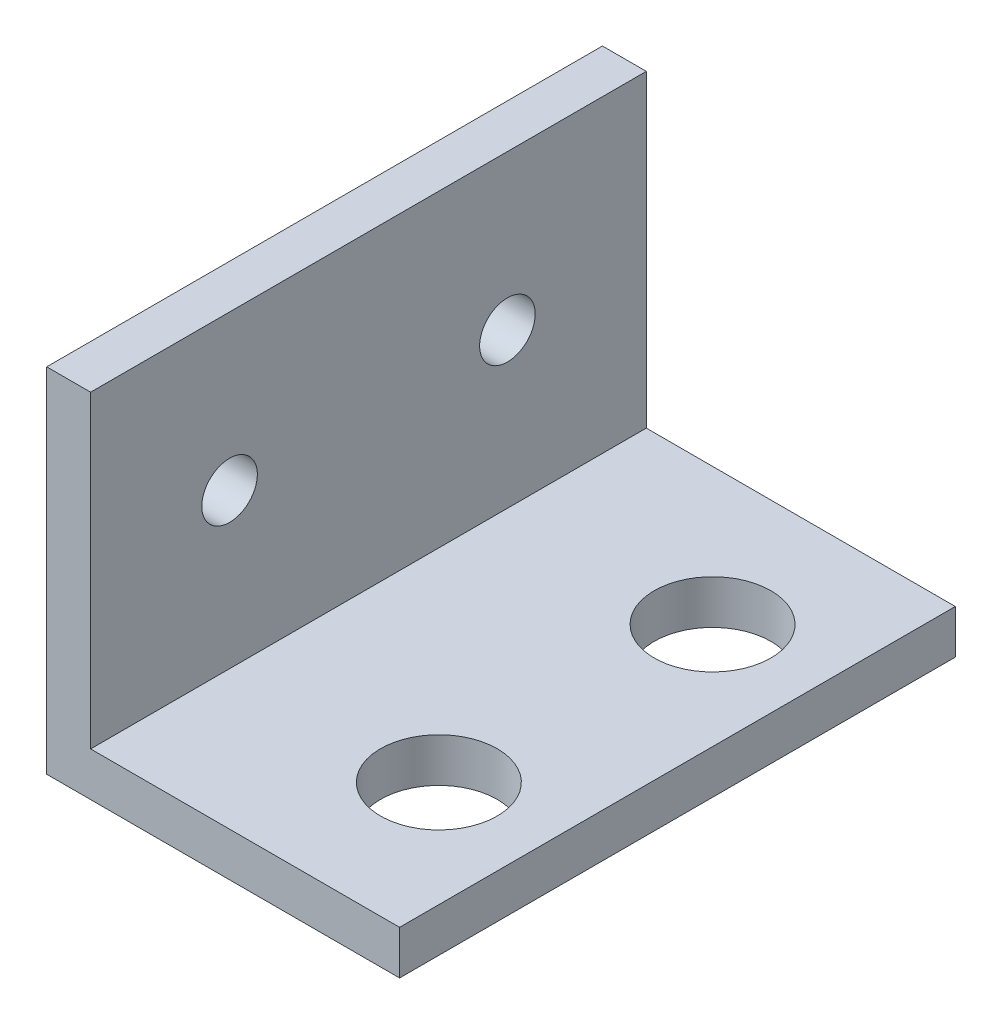
from build123d import *

# Parameters (mm, degrees)
BOSS_EXTRUDE1_DEPTH = 20
CUT_EXTRUDE1_REACH  = 28.881
CUT_EXTRUDE2_REACH  = 28.881


with BuildPart() as part:
    # Sketch1 → Boss-Extrude1 (new body)
    with BuildSketch(Plane.XY):
        Polygon((0, 0), (0, 12.7), (1.58, 12.7), (1.58, 1.58), (12.7, 1.58), (12.7, 0), align=None)
    extrude(amount=BOSS_EXTRUDE1_DEPTH)

    # Sketch2 → Cut-Extrude1 (cut, up to next)
    with BuildSketch(Plane.ZY, mode=Mode.PRIVATE) as cut_extrude1_sk1:
        with BuildLine():
            ThreePointArc((4, 7.14), (5, 6.14), (6, 7.14))
            Line((6, 7.14), (4, 7.14))
        make_face()
    cut_extrude1_tool1 = extrude(cut_extrude1_sk1.sketch, amount=-CUT_EXTRUDE1_REACH, mode=Mode.PRIVATE) & part.part
    # Sketch2 → Cut-Extrude1 (cut, up to next)
    with BuildSketch(Plane.ZY, mode=Mode.PRIVATE) as cut_extrude1_sk2:
        with BuildLine():
            Line((4, 7.14), (6, 7.14))
            ThreePointArc((6, 7.14), (5, 8.14), (4, 7.14))
        make_face()
    cut_extrude1_tool2 = extrude(cut_extrude1_sk2.sketch, amount=-CUT_EXTRUDE1_REACH, mode=Mode.PRIVATE) & part.part
    # Sketch2 → Cut-Extrude1 (cut, up to next)
    with BuildSketch(Plane.ZY, mode=Mode.PRIVATE) as cut_extrude1_sk3:
        with BuildLine():
            ThreePointArc((4, 7.14), (5, 6.14), (6, 7.14))
            Line((6, 7.14), (4, 7.14))
        make_face()
    cut_extrude1_tool3 = extrude(cut_extrude1_sk3.sketch, amount=-CUT_EXTRUDE1_REACH, mode=Mode.PRIVATE) & part.part
    # Sketch2 → Cut-Extrude1 (cut, up to next)
    with BuildSketch(Plane.ZY, mode=Mode.PRIVATE) as cut_extrude1_sk4:
        with BuildLine():
            Line((4, 7.14), (6, 7.14))
            ThreePointArc((6, 7.14), (5, 8.14), (4, 7.14))
        make_face()
    cut_extrude1_tool4 = extrude(cut_extrude1_sk4.sketch, amount=-CUT_EXTRUDE1_REACH, mode=Mode.PRIVATE) & part.part
    # Sketch2 → Cut-Extrude1 (cut, up to next)
    with BuildSketch(Plane.ZY, mode=Mode.PRIVATE) as cut_extrude1_sk5:
        with BuildLine():
            ThreePointArc((16, 7.14), (15, 8.14), (14, 7.14))
            Line((14, 7.14), (16, 7.14))
        make_face()
    cut_extrude1_tool5 = extrude(cut_extrude1_sk5.sketch, amount=-CUT_EXTRUDE1_REACH, mode=Mode.PRIVATE) & part.part
    # Sketch2 → Cut-Extrude1 (cut, up to next)
    with BuildSketch(Plane.ZY, mode=Mode.PRIVATE) as cut_extrude1_sk6:
        with BuildLine():
            Line((16, 7.14), (14, 7.14))
            ThreePointArc((14, 7.14), (15, 6.14), (16, 7.14))
        make_face()
    cut_extrude1_tool6 = extrude(cut_extrude1_sk6.sketch, amount=-CUT_EXTRUDE1_REACH, mode=Mode.PRIVATE) & part.part
    # Sketch2 → Cut-Extrude1 (cut, up to next)
    with BuildSketch(Plane.ZY, mode=Mode.PRIVATE) as cut_extrude1_sk7:
        with BuildLine():
            ThreePointArc((16, 7.14), (15, 8.14), (14, 7.14))
            Line((14, 7.14), (16, 7.14))
        make_face()
    cut_extrude1_tool7 = extrude(cut_extrude1_sk7.sketch, amount=-CUT_EXTRUDE1_REACH, mode=Mode.PRIVATE) & part.part
    # Sketch2 → Cut-Extrude1 (cut, up to next)
    with BuildSketch(Plane.ZY, mode=Mode.PRIVATE) as cut_extrude1_sk8:
        with BuildLine():
            Line((16, 7.14), (14, 7.14))
            ThreePointArc((14, 7.14), (15, 6.14), (16, 7.14))
        make_face()
    cut_extrude1_tool8 = extrude(cut_extrude1_sk8.sketch, amount=-CUT_EXTRUDE1_REACH, mode=Mode.PRIVATE) & part.part
    add(cut_extrude1_tool1.solids().sort_by_distance((0, 6.715587, 5))[0], mode=Mode.SUBTRACT)
    add(cut_extrude1_tool2.solids().sort_by_distance((0, 7.564413, 5))[0], mode=Mode.SUBTRACT)
    add(cut_extrude1_tool3.solids().sort_by_distance((0, 6.715587, 5))[0], mode=Mode.SUBTRACT)
    add(cut_extrude1_tool4.solids().sort_by_distance((0, 7.564413, 5))[0], mode=Mode.SUBTRACT)
    add(cut_extrude1_tool5.solids().sort_by_distance((0, 7.564413, 15))[0], mode=Mode.SUBTRACT)
    add(cut_extrude1_tool6.solids().sort_by_distance((0, 6.715587, 15))[0], mode=Mode.SUBTRACT)
    add(cut_extrude1_tool7.solids().sort_by_distance((0, 7.564413, 15))[0], mode=Mode.SUBTRACT)
    add(cut_extrude1_tool8.solids().sort_by_distance((0, 6.715587, 15))[0], mode=Mode.SUBTRACT)

    # Sketch3 → Cut-Extrude2 (cut, up to next)
    with BuildSketch(Plane.XZ, mode=Mode.PRIVATE) as cut_extrude2_sk1:
        with BuildLine():
            ThreePointArc((7.23357772, 6.217307692), (6.788854382, 4.925), (7.23357772, 3.632692308))
            ThreePointArc((7.23357772, 3.632692308), (9.572198735, 2.939290934), (10.988854382, 4.925))
            ThreePointArc((10.988854382, 4.925), (9.572198735, 6.910709066), (7.23357772, 6.217307692))
        make_face()
    cut_extrude2_tool1 = extrude(cut_extrude2_sk1.sketch, amount=-CUT_EXTRUDE2_REACH, mode=Mode.PRIVATE) & part.part
    # Sketch3 → Cut-Extrude2 (cut, up to next)
    with BuildSketch(Plane.XZ, mode=Mode.PRIVATE) as cut_extrude2_sk2:
        with BuildLine():
            ThreePointArc((7.23357772, 16.067307692), (6.788854382, 14.775), (7.23357772, 13.482692308))
            ThreePointArc((7.23357772, 13.482692308), (9.572198735, 12.789290934), (10.988854382, 14.775))
            ThreePointArc((10.988854382, 14.775), (9.572198735, 16.760709066), (7.23357772, 16.067307692))
        make_face()
    cut_extrude2_tool2 = extrude(cut_extrude2_sk2.sketch, amount=-CUT_EXTRUDE2_REACH, mode=Mode.PRIVATE) & part.part
    add(cut_extrude2_tool1.solids().sort_by_distance((8.888854, 0, 4.925))[0], mode=Mode.SUBTRACT)
    add(cut_extrude2_tool2.solids().sort_by_distance((8.888854, 0, 14.775))[0], mode=Mode.SUBTRACT)


solid = part.part
